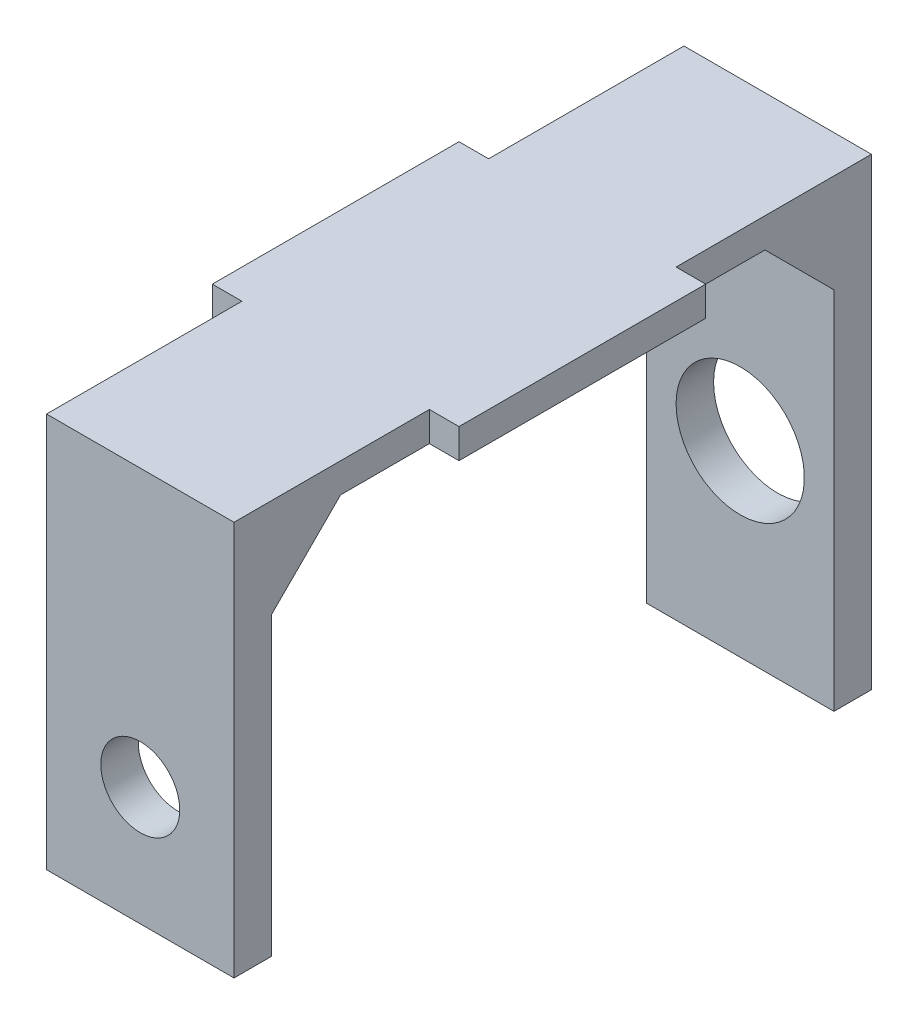
from build123d import *

# Parameters (mm, degrees)
IZIM1_W                       = 19
IZIM1_H                       = 3.8
Y_KSEKLIK_EKSTR_ZYON1_DEPTH   = 50
Y_KSEKLIK_EKSTR_ZYON1_2_DEPTH = 50
Y_KSEKLIK_EKSTR_ZYON2_DEPTH   = 3
IZIM3_R                       = 6.5
KES_EKSTR_ZYON1_DEPTH         = 5
IZIM4_R                       = 4
KES_EKSTR_ZYON2_DEPTH         = 5
IZIM5_W                       = 19
IZIM5_H                       = 6
KES_EKSTR_ZYON3_DEPTH         = 73
IZIM6_W                       = 19
IZIM6_H                       = 7
KES_EKSTR_ZYON4_DEPTH         = 9
Y_KSEKLIK_EKSTR_ZYON3_DEPTH   = 19


with BuildPart() as part:
    # Çizim1 → Yükseklik-Ekstrüzyon1 (new body)
    with BuildSketch(Plane(origin=(0, 0, 0), x_dir=(1, 0, 0), z_dir=(0, 1, 0))):
        with Locations((0, 58.9)):
            Rectangle(IZIM1_W, IZIM1_H)
    extrude(amount=Y_KSEKLIK_EKSTR_ZYON1_DEPTH)



with BuildPart() as body_2:
    # Çizim1 → Y_kseklik-Ekstr_zyon1 2 (new body)
    with BuildSketch(Plane(origin=(0, 0, 0), x_dir=(1, 0, 0), z_dir=(0, 1, 0))):
        with Locations((0, -1.9)):
            Rectangle(IZIM1_W, IZIM1_H)
    extrude(amount=Y_KSEKLIK_EKSTR_ZYON1_2_DEPTH)


with BuildPart() as part_1:
    add(part.part)

    add(body_2.part)  # Yükseklik-Ekstrüzyon2 merges body 2
    # Çizim2 → Yükseklik-Ekstrüzyon2 (add)
    with BuildSketch(Plane(origin=(0, 50, 0), x_dir=(1, 0, 0), z_dir=(0, 1, 0))):
        Polygon((-9.5, 60.8), (-9.5, 41), (-12.5, 41), (-12.5, 16), (-9.5, 16), (-9.5, -3.8), (9.5, -3.8), (9.5, 16), (12.5, 16), (12.5, 41), (9.5, 41), (9.5, 60.8), align=None)
    extrude(amount=Y_KSEKLIK_EKSTR_ZYON2_DEPTH)

    # Çizim3 → Kes-Ekstrüzyon1 (cut)
    with BuildSketch(Plane(origin=(0, 0, -60.8), x_dir=(-1, 0, 0), z_dir=(0, 0, -1))):
        with Locations((0, 25)):
            Circle(IZIM3_R)
    extrude(amount=-KES_EKSTR_ZYON1_DEPTH, mode=Mode.SUBTRACT)

    # Çizim4 → Kes-Ekstrüzyon2 (cut)
    with BuildSketch(Plane(origin=(0, 0, 0), x_dir=(-1, 0, 0), z_dir=(0, 0, -1))):
        with Locations((0, 25)):
            Circle(IZIM4_R)
    extrude(amount=-KES_EKSTR_ZYON2_DEPTH, mode=Mode.SUBTRACT)

    # Çizim5 → Kes-Ekstrüzyon3 (cut)
    with BuildSketch(Plane(origin=(0, 0, -60.8), x_dir=(-1, 0, 0), z_dir=(0, 0, -1))):
        with Locations((0, 3)):
            Rectangle(IZIM5_W, IZIM5_H)
    extrude(amount=-KES_EKSTR_ZYON3_DEPTH, mode=Mode.SUBTRACT)

    # Çizim6 → Kes-Ekstrüzyon4 (cut)
    with BuildSketch(Plane.XY.offset(3.8)):
        with Locations((0, 9.5)):
            Rectangle(IZIM6_W, IZIM6_H)
    extrude(amount=-KES_EKSTR_ZYON4_DEPTH, mode=Mode.SUBTRACT)

    # Çizim7 → Yükseklik-Ekstrüzyon3 (add)
    with BuildSketch(Plane(origin=(9.5, 0, 0), x_dir=(0, 0, -1), z_dir=(1, 0, 0))):
        Polygon((57, 50), (57, 43), (50, 50), align=None)
        Polygon((0, 50), (0, 43), (7, 50), align=None)
    extrude(amount=-Y_KSEKLIK_EKSTR_ZYON3_DEPTH)


solid = part_1.part
